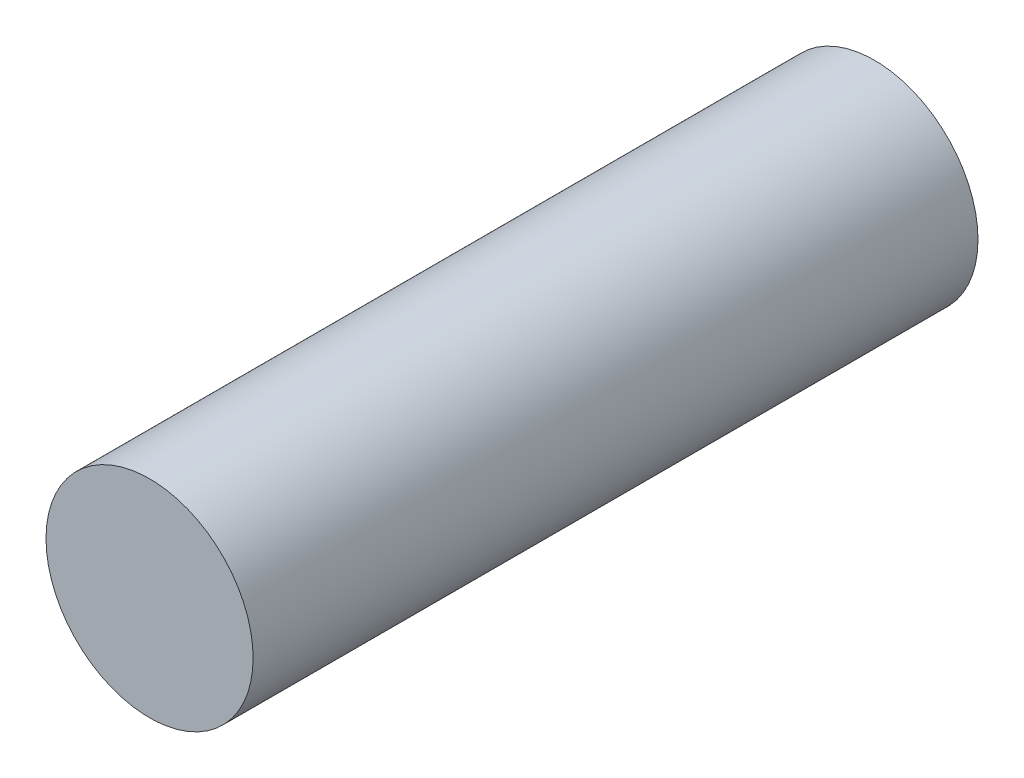
from build123d import *

# Parameters (mm, degrees)
SKETCH1_R           = 1
BOSS_EXTRUDE1_DEPTH = 7


with BuildPart() as part:
    # Sketch1 → Boss-Extrude1 (new body)
    with BuildSketch(Plane.XY):
        with Locations(Location((0, 0, 0), (0, 0, 180))):
            Circle(SKETCH1_R)
    extrude(amount=BOSS_EXTRUDE1_DEPTH)


solid = part.part
